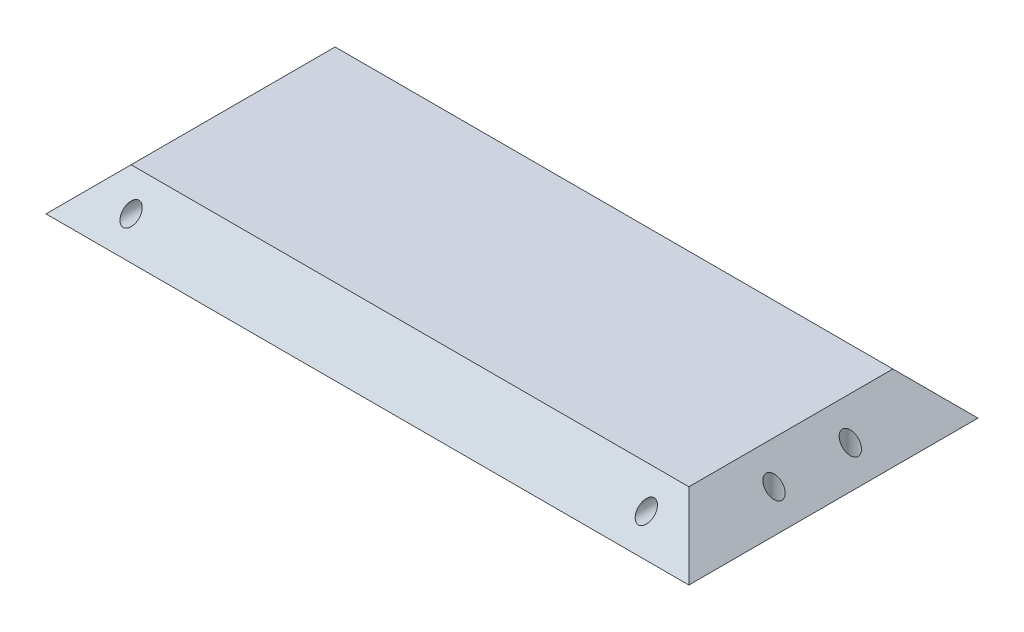
from build123d import *

# Parameters (mm, degrees)
SKETCH_4_R          = 1.85
CUT_EXTRUDE_1_DEPTH = 20
SKETCH_5_R          = 1.85
CUT_EXTRUDE_2_DEPTH = 84.417206125


with BuildPart() as part:
    # Эскиз1 → По сечениям1 section 0
    with BuildSketch(Plane(origin=(0, 0, 0), x_dir=(1, 0, 0), z_dir=(0, 1, 0))):
        with BuildLine():
            Line((-75.529594285, -33.966316269), (75.529594285, -33.966316269))
            Line((75.529594285, -33.966316269), (75.529594285, 33.966316269))
            Line((75.529594285, 33.966316269), (-75.529594285, 33.966316269))
            Line((-75.529594285, 33.966316269), (-75.529594285, -33.966316269))
        make_face()
    # Эскиз2 → По сечениям1 section 1
    with BuildSketch(Plane(origin=(0, 10, 0), x_dir=(1, 0, 0), z_dir=(0, 1, 0))):
        with BuildLine():
            Line((65.529594285, -23.966316269), (65.529594285, 23.966316269))
            Line((65.529594285, 23.966316269), (-65.529594285, 23.966316269))
            Line((-65.529594285, 23.966316269), (-65.529594285, -23.966316269))
            Line((-65.529594285, -23.966316269), (65.529594285, -23.966316269))
        make_face()
    loft()

    # Эскиз4 → Вырез-Вытянуть1 (cut)
    with BuildSketch(Plane.XY.offset(33.966316269)):
        with Locations((-60.529594285, 5)):
            Circle(SKETCH_4_R)
        with Locations(Location((60.529594285, 5, 0), (0, 0, 270))):
            Circle(SKETCH_4_R)
    cut_extrude_1 = extrude(amount=-CUT_EXTRUDE_1_DEPTH, mode=Mode.SUBTRACT)

    # Зеркальное отражение1: Вырез-Вытянуть1 across plane
    add(cut_extrude_1.mirror(Plane.XY), mode=Mode.SUBTRACT)

    # Эскиз5 → Вырез-Вытянуть2 (cut, through all)
    with BuildSketch(Plane.XZ):
        with Locations(Location((-70.529594285, 8.966316269, 0), (0, 0, 270))):
            Circle(SKETCH_5_R)
        with Locations(Location((-70.529594285, -8.966316269, 0), (0, 0, 180))):
            Circle(SKETCH_5_R)
        with Locations(Location((70.529594285, -8.966316269, 0), (0, 0, 270))):
            Circle(SKETCH_5_R)
        with Locations((70.529594285, 8.966316269)):
            Circle(SKETCH_5_R)
    extrude(amount=-CUT_EXTRUDE_2_DEPTH, mode=Mode.SUBTRACT)


solid = part.part
